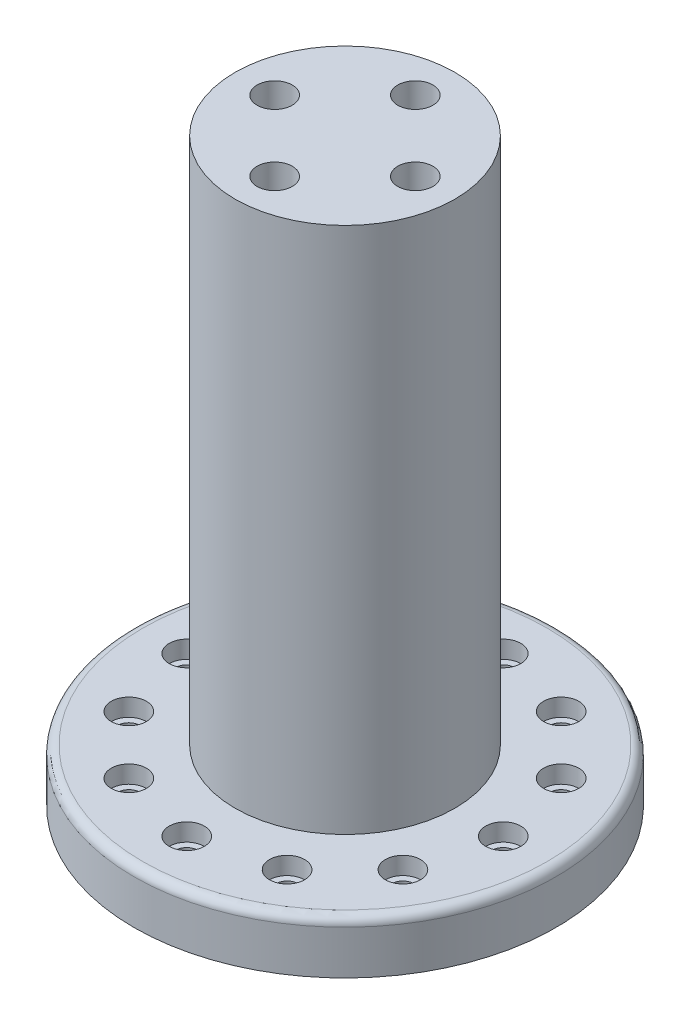
from build123d import *

# Parameters (mm, degrees)
SKETCH1_R           = 24
BOSS_EXTRUDE1_DEPTH = 6
SKETCH2_R           = 2
CUT_EXTRUDE1_DEPTH  = 2
SKETCH3_R           = 1.25
CUT_EXTRUDE2_DEPTH  = 35.176014981
SKETCH4_R           = 12.5
BOSS_EXTRUDE2_DEPTH = 60
SKETCH5_R           = 8.5
CUT_EXTRUDE3_DEPTH  = 5
FILLET1_R           = 1
SKETCH6_R           = 2
CUT_EXTRUDE4_DEPTH  = 20


with BuildPart() as part:
    # Sketch1 → Boss-Extrude1 (new body)
    with BuildSketch(Plane(origin=(0, 0, 0), x_dir=(1, 0, 0), z_dir=(0, 1, 0))):
        with Locations(Location((0, 0, 0), (0, 0, 270))):
            Circle(SKETCH1_R)
    extrude(amount=BOSS_EXTRUDE1_DEPTH)

    # Sketch2 → Cut-Extrude1 (cut)
    with BuildSketch(Plane(origin=(0, 6, 0), x_dir=(1, 0, 0), z_dir=(0, 1, 0))):
        with Locations(Location((0, 18, 0), (0, 0, 270))):
            Circle(SKETCH2_R)
        with Locations(Location((9, 15.588457268, 0), (0, 0, 270))):
            Circle(SKETCH2_R)
        with Locations(Location((15.588457268, 9, 0), (0, 0, 270))):
            Circle(SKETCH2_R)
        with Locations(Location((18, 0, 0), (0, 0, 270))):
            Circle(SKETCH2_R)
        with Locations(Location((15.588457268, -9, 0), (0, 0, 270))):
            Circle(SKETCH2_R)
        with Locations(Location((9, -15.588457268, 0), (0, 0, 270))):
            Circle(SKETCH2_R)
        with Locations(Location((0, -18, 0), (0, 0, 270))):
            Circle(SKETCH2_R)
        with Locations(Location((-9, -15.588457268, 0), (0, 0, 270))):
            Circle(SKETCH2_R)
        with Locations(Location((-15.588457268, -9, 0), (0, 0, 270))):
            Circle(SKETCH2_R)
        with Locations(Location((-18, 0, 0), (0, 0, 270))):
            Circle(SKETCH2_R)
        with Locations(Location((-15.588457268, 9, 0), (0, 0, 270))):
            Circle(SKETCH2_R)
        with Locations(Location((-9, 15.588457268, 0), (0, 0, 270))):
            Circle(SKETCH2_R)
    extrude(amount=-CUT_EXTRUDE1_DEPTH, mode=Mode.SUBTRACT)

    # Sketch3 → Cut-Extrude2 (cut, through all)
    with BuildSketch(Plane(origin=(0, 4, 0), x_dir=(1, 0, 0), z_dir=(0, 1, 0))):
        with Locations(Location((0, 18, 0), (0, 0, 270))):
            Circle(SKETCH3_R)
        with Locations(Location((9, 15.588457268, 0), (0, 0, 270))):
            Circle(SKETCH3_R)
        with Locations(Location((15.588457268, 9, 0), (0, 0, 270))):
            Circle(SKETCH3_R)
        with Locations(Location((18, 0, 0), (0, 0, 270))):
            Circle(SKETCH3_R)
        with Locations(Location((15.588457268, -9, 0), (0, 0, 270))):
            Circle(SKETCH3_R)
        with Locations(Location((9, -15.588457268, 0), (0, 0, 270))):
            Circle(SKETCH3_R)
        with Locations(Location((0, -18, 0), (0, 0, 270))):
            Circle(SKETCH3_R)
        with Locations(Location((-9, -15.588457268, 0), (0, 0, 270))):
            Circle(SKETCH3_R)
        with Locations(Location((-15.588457268, -9, 0), (0, 0, 270))):
            Circle(SKETCH3_R)
        with Locations(Location((-18, 0, 0), (0, 0, 270))):
            Circle(SKETCH3_R)
        with Locations(Location((-15.588457268, 9, 0), (0, 0, 270))):
            Circle(SKETCH3_R)
        with Locations(Location((-9, 15.588457268, 0), (0, 0, 270))):
            Circle(SKETCH3_R)
    extrude(amount=-CUT_EXTRUDE2_DEPTH, mode=Mode.SUBTRACT)

    # Sketch4 → Boss-Extrude2 (add)
    with BuildSketch(Plane(origin=(0, 6, 0), x_dir=(1, 0, 0), z_dir=(0, 1, 0))):
        with Locations(Location((0, 0, 0), (0, 0, 270))):
            Circle(SKETCH4_R)
    extrude(amount=BOSS_EXTRUDE2_DEPTH)

    # Sketch5 → Cut-Extrude3 (cut)
    with BuildSketch(Plane.XZ):
        with Locations(Location((0, 0, 0), (0, 0, 270))):
            Circle(SKETCH5_R)
    extrude(amount=-CUT_EXTRUDE3_DEPTH, mode=Mode.SUBTRACT)

    # Fillet1
    fillet1_edges = [part.edges().sort_by_distance(p)[0] for p in [
        (0, 6, -24),
    ]]
    fillet(fillet1_edges, radius=FILLET1_R)

    # Sketch6 → Cut-Extrude4 (cut)
    with BuildSketch(Plane(origin=(0, 66, 0), x_dir=(1, 0, 0), z_dir=(0, 1, 0))):
        with Locations(Location((0, 8, 0), (0, 0, 270))):
            Circle(SKETCH6_R)
        with Locations(Location((8, 0, 0), (0, 0, 270))):
            Circle(SKETCH6_R)
        with Locations(Location((0, -8, 0), (0, 0, 270))):
            Circle(SKETCH6_R)
        with Locations(Location((-8, 0, 0), (0, 0, 270))):
            Circle(SKETCH6_R)
    extrude(amount=-CUT_EXTRUDE4_DEPTH, mode=Mode.SUBTRACT)


solid = part.part
